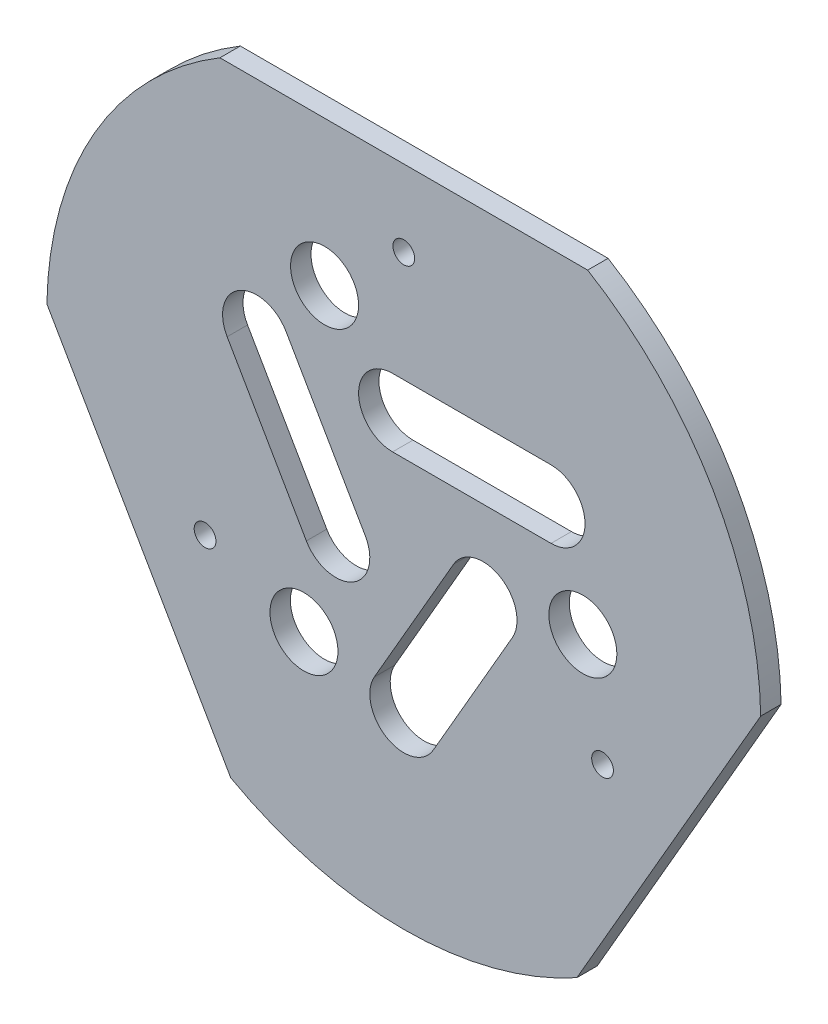
from build123d import *

# Parameters (mm, degrees)
SKETCH_1_R               = 1.6
SKETCH_1_R_2             = 5
EXTRUDE_1_DEPTH          = 1.5
CUT_EXTRUDE_1_DEPTH      = 75.301116494
PATTERN_CIRCULAR_1_COUNT = 3
SKETCH_3_R               = 5
CUT_EXTRUDE_3_DEPTH      = 75.301116494
PATTERN_CIRCULAR_3_COUNT = 3


with BuildPart() as part:
    # 草图1 → 凸台-拉伸1 (new, symmetric)
    with BuildSketch(Plane.XY):
        with BuildLine():
            Line((25.450325887, -45.918742494), (52.491960453, 0.918742494))
            ThreePointArc((52.491960453, 0.918742494), (45.466333699, 26.25), (27.041634566, 45))
            Line((27.041634566, 45), (-27.041634566, 45))
            ThreePointArc((-27.041634566, 45), (-45.466333699, 26.25), (-52.491960453, 0.918742494))
            Line((-52.491960453, 0.918742494), (-25.450325887, -45.918742494))
            ThreePointArc((-25.450325887, -45.918742494), (0, -52.5), (25.450325887, -45.918742494))
        make_face()
        with Locations((0, 33.75)):
            Circle(SKETCH_1_R, mode=Mode.SUBTRACT)
        with Locations((29.228357378, -16.875)):
            Circle(SKETCH_1_R, mode=Mode.SUBTRACT)
        with Locations((-29.228357378, -16.875)):
            Circle(SKETCH_1_R, mode=Mode.SUBTRACT)
        with Locations((0, -25)):
            Circle(SKETCH_1_R_2, mode=Mode.SUBTRACT)
        with Locations((-21.650635095, 12.5)):
            Circle(SKETCH_1_R_2, mode=Mode.SUBTRACT)
        with Locations((21.650635095, 12.5)):
            Circle(SKETCH_1_R_2, mode=Mode.SUBTRACT)
    extrude(amount=EXTRUDE_1_DEPTH, both=True)

    # 草图2 → 切除-拉伸1 (cut, through all)
    with BuildSketch(Plane.XY.offset(1.5)):
        with BuildLine():
            Line((-17.320508076, 15), (-5.669872981, -5.179491924))
            ThreePointArc((-5.669872981, -5.179491924), (-7.5, -12.009618943), (-14.330127019, -10.179491924))
            Line((-14.330127019, -10.179491924), (-25.980762114, 10))
            ThreePointArc((-25.980762114, 10), (-24.150635095, 16.830127019), (-17.320508076, 15))
        make_face()
    cut_extrude_1 = extrude(amount=-CUT_EXTRUDE_1_DEPTH, mode=Mode.SUBTRACT)

    # 阵列(圆周)1: 切除-拉伸1 ×3 about axis
    pattern_circular_1_axis = Axis((0, 0, 0), (0, 0, 1))
    for i in range(1, PATTERN_CIRCULAR_1_COUNT):
        add(cut_extrude_1.rotate(pattern_circular_1_axis, i * 360 / PATTERN_CIRCULAR_1_COUNT), mode=Mode.SUBTRACT)

    # 草图3 → 切除-拉伸3 (cut, through all)
    with BuildSketch(Plane.XY.offset(1.5)):
        with Locations((-11.650635095, 23.680339887)):
            Circle(SKETCH_3_R)
    cut_extrude_3 = extrude(amount=-CUT_EXTRUDE_3_DEPTH, mode=Mode.SUBTRACT)

    # 阵列(圆周)3: 切除-拉伸3 ×3 about axis
    pattern_circular_3_axis = Axis((0, 0, 0), (0, 0, 1))
    for i in range(1, PATTERN_CIRCULAR_3_COUNT):
        add(cut_extrude_3.rotate(pattern_circular_3_axis, i * 360 / PATTERN_CIRCULAR_3_COUNT), mode=Mode.SUBTRACT)


solid = part.part
